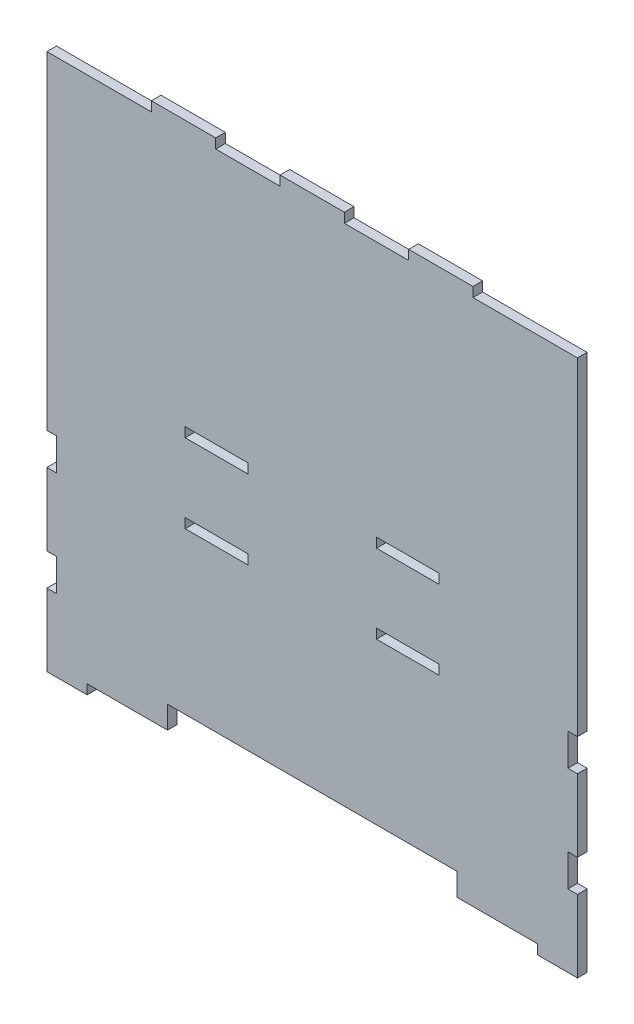
from build123d import *

# Parameters (mm, degrees)
ESQUISSE1_W             = 330
ESQUISSE1_H             = 340
BOSS_EXTRU_1_DEPTH      = 6
ESQUISSE2_W             = 39
ESQUISSE2_H             = 6
ESQUISSE2_W_2           = 6
ESQUISSE2_H_2           = 20
ESQUISSE2_W_3           = 65
ESQUISSE2_W_4           = 40
ENL_V_MAT_ENCOCHE_DEPTH = 474.852297662


with BuildPart() as part:
    # Esquisse1 → Boss.-Extru.1 (new body)
    with BuildSketch(Plane.XY):
        with Locations((-165, 170)):
            Rectangle(ESQUISSE1_W, ESQUISSE1_H)
    extrude(amount=BOSS_EXTRU_1_DEPTH)

    # Esquisse2 → Enlèv. mat encoche (cut, through all)
    with BuildSketch(Plane.XY.offset(6)):
        with Locations((-224.5, 172)):
            Rectangle(ESQUISSE2_W, ESQUISSE2_H)
        with Locations((-105.5, 172)):
            Rectangle(ESQUISSE2_W, ESQUISSE2_H)
        with Locations((-327, 120)):
            Rectangle(ESQUISSE2_W_2, ESQUISSE2_H_2)
        with Locations((-327, 55)):
            Rectangle(ESQUISSE2_W_2, ESQUISSE2_H_2)
        with Locations((-3, 120)):
            Rectangle(ESQUISSE2_W_2, ESQUISSE2_H_2)
        with Locations((-3, 55)):
            Rectangle(ESQUISSE2_W_2, ESQUISSE2_H_2)
        with Locations((-224.5, 123)):
            Rectangle(ESQUISSE2_W, ESQUISSE2_H)
        with Locations((-105.5, 123)):
            Rectangle(ESQUISSE2_W, ESQUISSE2_H)
        with Locations((-297.5, 337)):
            Rectangle(ESQUISSE2_W_3, ESQUISSE2_H)
        with Locations((-205, 337)):
            Rectangle(ESQUISSE2_W_4, ESQUISSE2_H)
        with Locations((-125, 337)):
            Rectangle(ESQUISSE2_W_4, ESQUISSE2_H)
        with Locations((-32.5, 337)):
            Rectangle(ESQUISSE2_W_3, ESQUISSE2_H)
        Polygon((-305, 0), (-255, 0), (-75, 0), (-25, 0), (-25, 6), (-75, 6), (-75, 20), (-255, 20), (-255, 6), (-305, 6), align=None)
    extrude(amount=-ENL_V_MAT_ENCOCHE_DEPTH, mode=Mode.SUBTRACT)


solid = part.part
